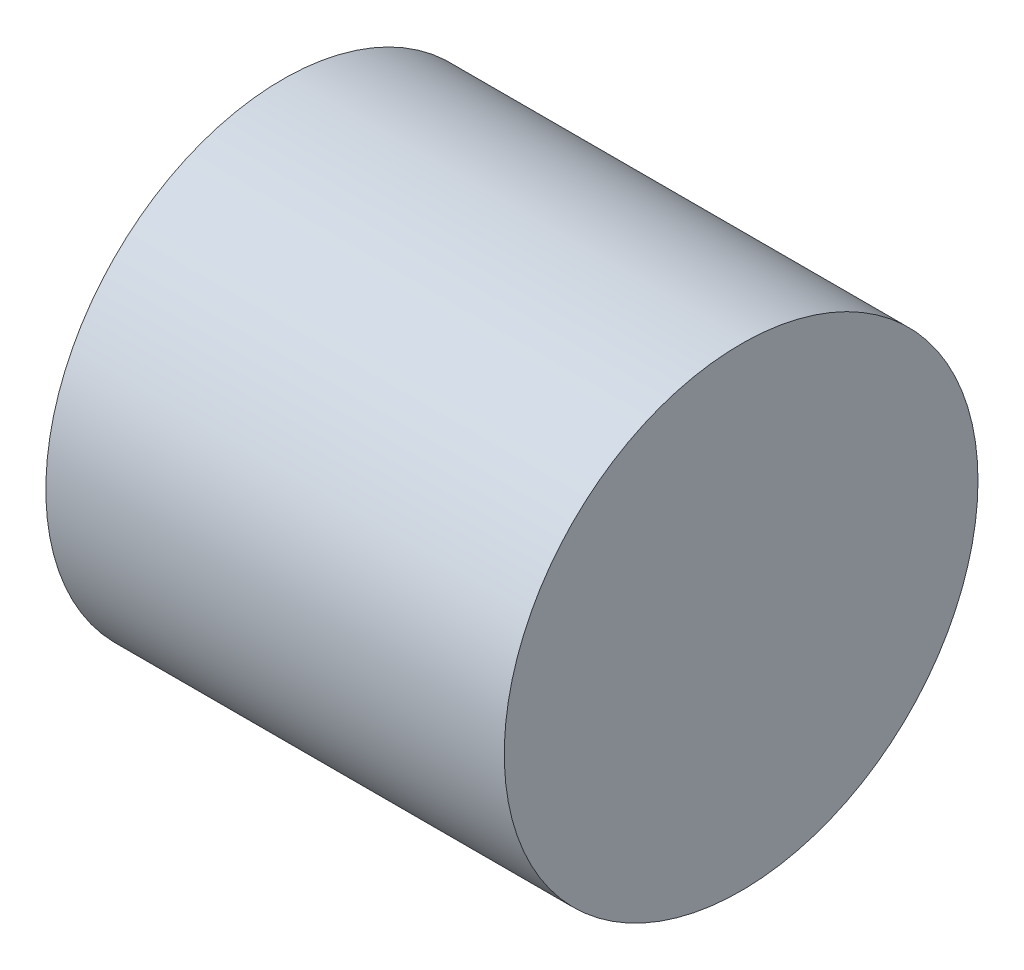
from build123d import *

# Parameters (mm, degrees)
CURVESKETCH_R   = 6.817
CURVEBOSS_DEPTH = 13.193


with BuildPart() as part:
    # CurveSketch → CurveBoss (new body)
    with BuildSketch(Plane(origin=(0, 0, 0), x_dir=(0, 0, -1), z_dir=(1, 0, 0))):
        with Locations((3.719, -5.983)):
            Circle(CURVESKETCH_R)
    extrude(amount=CURVEBOSS_DEPTH)


solid = part.part
